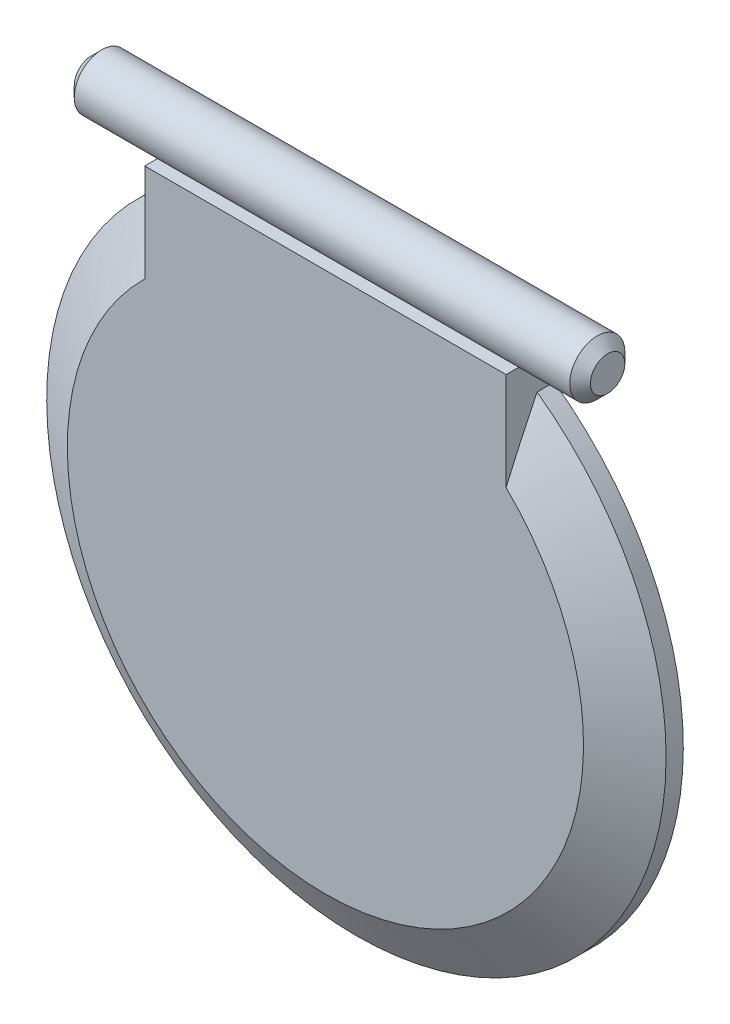
from build123d import *

# Parameters (mm, degrees)
BOSS_EXTRUDE1_DEPTH      = 7
BOSS_EXTRUDE2_DEPTH      = 75
BOSS_EXTRUDE2_DEPTH_BACK = 75
SKETCH6_R                = 8
CHAMFER1_SIZE            = 3
SKETCH11_W               = 105
SKETCH11_H               = 28.439286786
BOSS_EXTRUDE3_DEPTH      = 14


with BuildPart() as part:
    # Sketch1 → Boss-Extrude1 (new, symmetric)
    with BuildSketch(Plane.XY):
        with BuildLine():
            Line((-52.5, 73.100957586), (-52.5, 82))
            Line((-52.5, 82), (52.5, 82))
            Line((52.5, 82), (52.5, 73.100957586))
            ThreePointArc((52.5, 73.100957586), (0, -90), (-52.5, 73.100957586))
        make_face()
    extrude(amount=BOSS_EXTRUDE1_DEPTH, both=True)

    # Sketch7 → Cut-Revolve2 (revolve, cut)
    with BuildSketch(Plane(origin=(0, 0, 0), x_dir=(1, 0, 0), z_dir=(0, 1, 0)), mode=Mode.PRIVATE) as cut_revolve2_sk:
        Polygon((-90, -7), (-90, 2), (-75, -7), align=None)
    revolve(cut_revolve2_sk.sketch.rotate(Axis((0, 0, 0), (0, 0, -1)), 54.314665287), axis=Axis((0, 0, 0), (0, 0, -1)), mode=Mode.SUBTRACT)

    # Sketch11 → Boss-Extrude3 (add)
    with BuildSketch(Plane.XY.offset(7)):
        with Locations((0, 67.780356607)):
            Rectangle(SKETCH11_W, SKETCH11_H)
    extrude(amount=-BOSS_EXTRUDE3_DEPTH)


with BuildPart() as body_2:
    # Sketch6 → Boss-Extrude2 (new, two sides: drawn at the far end of the back side and taken through both)
    with BuildSketch(Plane(origin=(0, 0, 0), x_dir=(0, 0, -1), z_dir=(1, 0, 0)).offset(-BOSS_EXTRUDE2_DEPTH_BACK)):
        with Locations(Location((0, 90, 0), (0, 0, 180))):
            Circle(SKETCH6_R)
    extrude(amount=BOSS_EXTRUDE2_DEPTH + BOSS_EXTRUDE2_DEPTH_BACK)

    # Chamfer1
    chamfer1_edges = [body_2.edges().sort_by_distance(p)[0] for p in [
        (75, 90, -8),
        (-75, 90, -8),
    ]]
    chamfer(chamfer1_edges, length=CHAMFER1_SIZE)


solid = Compound([part.part, body_2.part])
